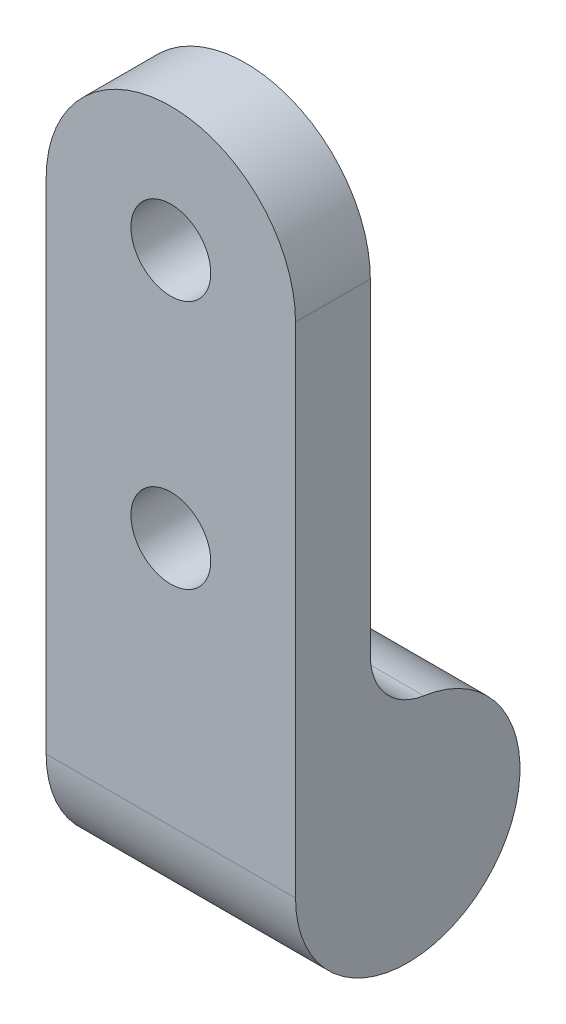
from build123d import *

# Parameters (mm, degrees)
EXTRUDE_1_DEPTH     = 10
SKETCH_3_R          = 1.6
CUT_EXTRUDE_1_DEPTH = 28.586228448


with BuildPart() as part:
    # 草图2 → 凸台-拉伸1 (new body)
    with BuildSketch(Plane(origin=(0, 0, 0), x_dir=(0, 0, -1), z_dir=(1, 0, 0))):
        with BuildLine():
            Line((-4.5, 25), (-1.5, 25))
            Line((-1.5, 25), (-1.5, 6.92820323))
            ThreePointArc((-1.5, 6.92820323), (-0.889822365, 5.291569054), (0.642857143, 4.453844934))
            ThreePointArc((0.642857143, 4.453844934), (2.945941518, -3.401680257), (-4.5, 0))
            Line((-4.5, 0), (-4.5, 25))
        make_face()
    extrude(amount=EXTRUDE_1_DEPTH)

    # 草图3 → 切除-拉伸1 (cut, through all)
    with BuildSketch(Plane(origin=(0, 0, 1.5), x_dir=(-1, 0, 0), z_dir=(0, 0, -1))):
        with BuildLine():
            Line((-10, 25), (-10, 20))
            ThreePointArc((-10, 20), (-8.535533906, 23.535533906), (-5, 25))
            Line((-5, 25), (-10, 25))
        make_face()
        with BuildLine():
            Line((0, 25), (-5, 25))
            ThreePointArc((-5, 25), (-1.464466094, 23.535533906), (0, 20))
            Line((0, 20), (0, 25))
        make_face()
        with Locations(Location((-5, 20, 0), (0, 0, 90))):
            Circle(SKETCH_3_R)
        with Locations(Location((-5, 10, 0), (0, 0, 90))):
            Circle(SKETCH_3_R)
    extrude(amount=-CUT_EXTRUDE_1_DEPTH, mode=Mode.SUBTRACT)


solid = part.part
